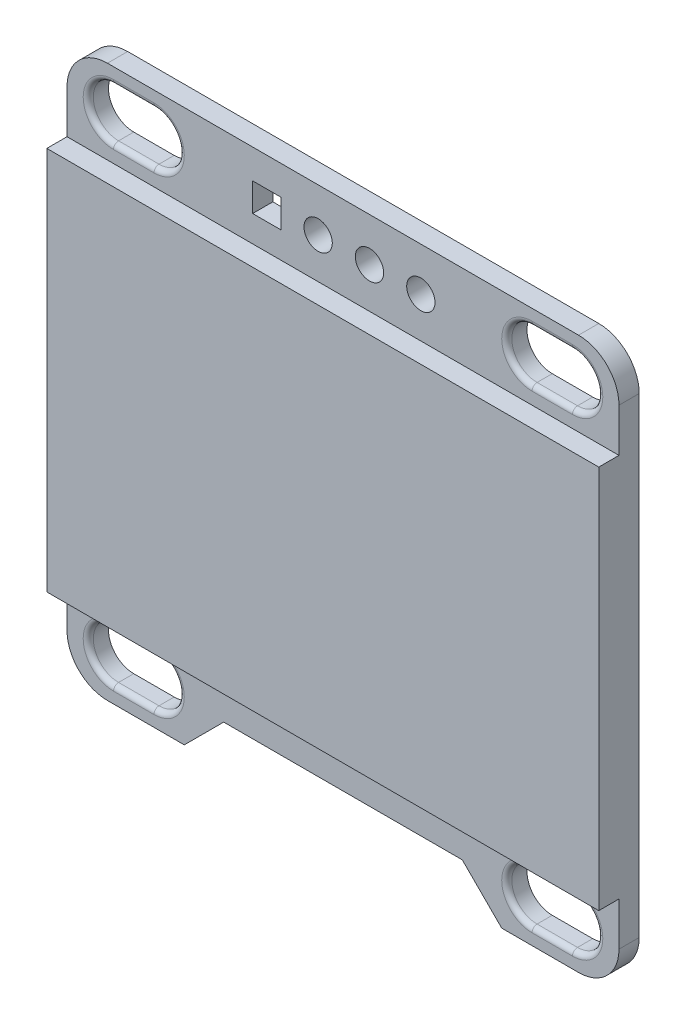
from build123d import *

# Parameters (mm, degrees)
SKETCH1_W           = 27.3
SKETCH1_H           = 27.3
BOSS_EXTRUDE1_DEPTH = 1
FILLET1_R           = 2
CUT_EXTRUDE1_DEPTH  = 2
SKETCH5_W           = 27.3
SKETCH5_H           = 19
BOSS_EXTRUDE2_DEPTH = 1
CUT_EXTRUDE2_DEPTH  = 2
FILLET2_R           = 0.25
SKETCH7_R           = 0.7
SKETCH7_W           = 1.4
SKETCH7_H           = 1.4
CUT_EXTRUDE3_DEPTH  = 1


with BuildPart() as part:
    # Sketch1 → Boss-Extrude1 (new body)
    with BuildSketch(Plane.XY):
        Rectangle(SKETCH1_W, SKETCH1_H)
    extrude(amount=BOSS_EXTRUDE1_DEPTH)

    # Fillet1
    fillet1_edges = [part.edges().sort_by_distance(p)[0] for p in [
        (13.65, -13.65, 0.5),
        (-13.65, -13.65, 0.5),
        (-13.65, 13.65, 0.5),
        (13.65, 13.65, 0.5),
    ]]
    fillet(fillet1_edges, radius=FILLET1_R)

    # Sketch2 → Cut-Extrude1 (cut)
    with BuildSketch(Plane.XY.offset(1)):
        with BuildLine():
            Line((-11.35, 12.85), (-9.35, 12.85))
            ThreePointArc((-9.35, 12.85), (-8.1, 11.6), (-9.35, 10.35))
            Line((-9.35, 10.35), (-11.35, 10.35))
            ThreePointArc((-11.35, 10.35), (-12.6, 11.6), (-11.35, 12.85))
        make_face()
        with BuildLine():
            Line((11.35, 10.35), (9.35, 10.35))
            ThreePointArc((9.35, 10.35), (8.1, 11.6), (9.35, 12.85))
            Line((9.35, 12.85), (11.35, 12.85))
            ThreePointArc((11.35, 12.85), (12.6, 11.6), (11.35, 10.35))
        make_face()
        with BuildLine():
            Line((-11.35, -10.35), (-9.35, -10.35))
            ThreePointArc((-9.35, -10.35), (-8.1, -11.6), (-9.35, -12.85))
            Line((-9.35, -12.85), (-11.35, -12.85))
            ThreePointArc((-11.35, -12.85), (-12.6, -11.6), (-11.35, -10.35))
        make_face()
        with BuildLine():
            Line((11.35, -12.85), (9.35, -12.85))
            ThreePointArc((9.35, -12.85), (8.1, -11.6), (9.35, -10.35))
            Line((9.35, -10.35), (11.35, -10.35))
            ThreePointArc((11.35, -10.35), (12.6, -11.6), (11.35, -12.85))
        make_face()
    extrude(amount=-CUT_EXTRUDE1_DEPTH, mode=Mode.SUBTRACT)

    # Sketch5 → Boss-Extrude2 (add)
    with BuildSketch(Plane.XY.offset(1)):
        Rectangle(SKETCH5_W, SKETCH5_H)
    extrude(amount=BOSS_EXTRUDE2_DEPTH)

    # Sketch3 → Cut-Extrude2 (cut)
    with BuildSketch(Plane.XY.offset(1)):
        Polygon((-7.85, -13.65), (-5.9, -11.7), (5.9, -11.7), (7.85, -13.65), align=None)
    extrude(amount=-CUT_EXTRUDE2_DEPTH, mode=Mode.SUBTRACT)

    # Fillet2
    fillet2_edges = [part.edges().sort_by_distance(p)[0] for p in [
        (12.6, 11.6, 1),
        (10.35, 12.85, 1),
        (8.1, 11.6, 1),
        (10.35, 10.35, 1),
        (-12.6, -11.6, 1),
        (-10.35, -12.85, 1),
        (-8.1, -11.6, 1),
        (-10.35, -10.35, 1),
        (12.6, -11.6, 1),
        (10.35, -10.35, 1),
        (8.1, -11.6, 1),
        (10.35, -12.85, 1),
        (-12.6, 11.6, 1),
        (-10.35, 10.35, 1),
        (-8.1, 11.6, 1),
        (-10.35, 12.85, 1),
    ]]
    fillet(fillet2_edges, radius=FILLET2_R)

    # Sketch7 → Cut-Extrude3 (cut)
    with BuildSketch(Plane(origin=(0, 0, 0), x_dir=(-1, 0, 0), z_dir=(0, 0, -1))):
        with Locations((-3.85, 11.5)):
            Circle(SKETCH7_R)
        with Locations((-1.31, 11.5)):
            Circle(SKETCH7_R)
        with Locations((1.23, 11.5)):
            Circle(SKETCH7_R)
        with Locations((3.77, 11.5)):
            Rectangle(SKETCH7_W, SKETCH7_H)
    extrude(amount=-CUT_EXTRUDE3_DEPTH, mode=Mode.SUBTRACT)


solid = part.part
